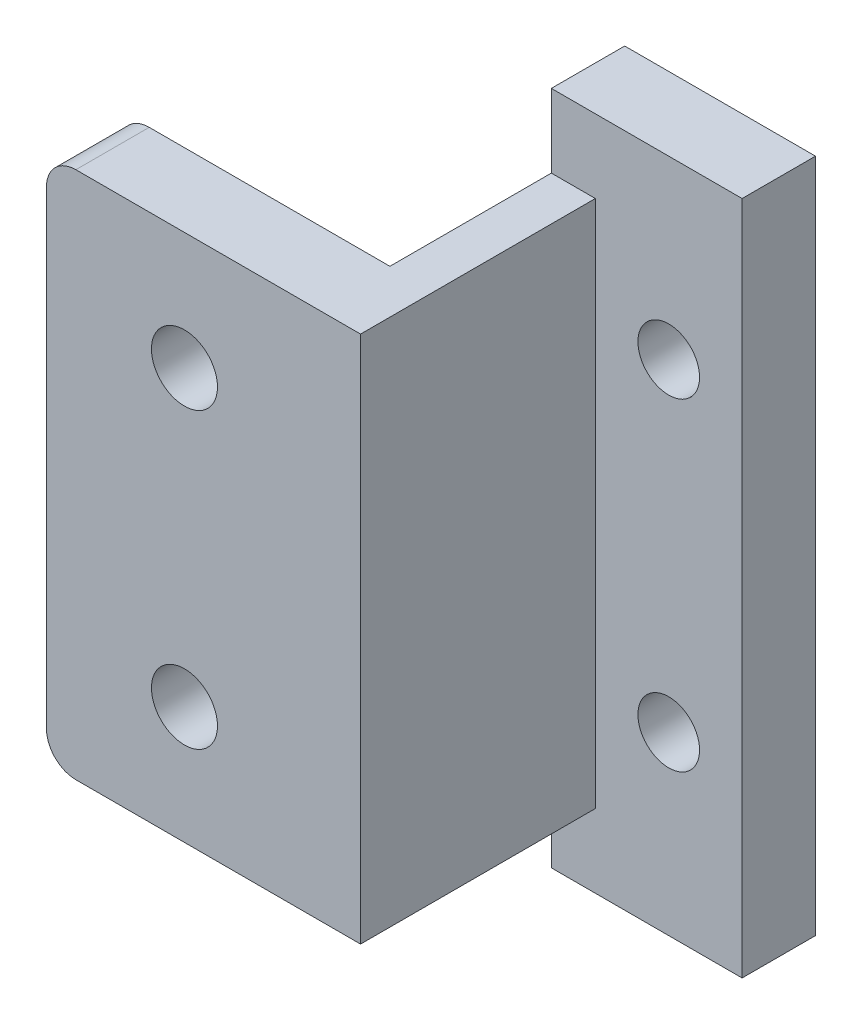
from build123d import *

# Parameters (mm, degrees)
ESQUISSE1_R             = 2.25
BOSS_EXTRU_1_DEPTH      = 5
BOSS_EXTRU_2_START      = -21
BOSS_EXTRU_2_DEPTH      = 21
ESQUISSE4_W             = 13
ESQUISSE4_H             = 46
ENL_V_MAT_EXTRU_2_DEPTH = 16
ESQUISSE9_W             = 16
ESQUISSE9_H             = 36
BOSS_EXTRU_3_DEPTH      = 3
ESQUISSE10_W            = 4
ESQUISSE10_H            = 16
ENL_V_MAT_EXTRU_6_DEPTH = 43
CONG_1_R                = 2
ESQUISSE11_R            = 2.1
ENL_V_MAT_EXTRU_7_DEPTH = 43


with BuildPart() as part:
    # Esquisse1 → Boss.-Extru.1 (new body)
    with BuildSketch(Plane.XY):
        with BuildLine():
            Line((-7.4, 36), (-7.4, 0))
            Line((-7.4, 0), (7, 0))
            ThreePointArc((7, 0), (9.121320344, 0.878679656), (10, 3))
            Line((10, 3), (10, 33))
            ThreePointArc((10, 33), (9.121320344, 35.121320344), (7, 36))
            Line((7, 36), (-7.4, 36))
        make_face()
        with Locations((2, 8)):
            Circle(ESQUISSE1_R, mode=Mode.SUBTRACT)
        with Locations((2, 28)):
            Circle(ESQUISSE1_R, mode=Mode.SUBTRACT)
    extrude(amount=BOSS_EXTRU_1_DEPTH)

    # Esquisse2 → Boss.-Extru.2 (add)
    with BuildSketch(Plane.XY.offset(5).offset(BOSS_EXTRU_2_START)):
        with BuildLine():
            Line((10, 3), (10, 33))
            ThreePointArc((10, 33), (9.121320344, 35.121320344), (7, 36))
            Line((7, 36), (11, 36))
            Line((11, 36), (11, 41))
            Line((11, 41), (24, 41))
            Line((24, 41), (24, -5))
            Line((24, -5), (11, -5))
            Line((11, -5), (11, 0))
            Line((11, 0), (7, 0))
            ThreePointArc((7, 0), (9.121320344, 0.878679656), (10, 3))
        make_face()
    extrude(amount=BOSS_EXTRU_2_DEPTH)

    # Esquisse4 → Enlèv. mat.-Extru.2 (cut)
    with BuildSketch(Plane.XY.offset(5)):
        with Locations((17.5, 18)):
            Rectangle(ESQUISSE4_W, ESQUISSE4_H)
    extrude(amount=-ENL_V_MAT_EXTRU_2_DEPTH, mode=Mode.SUBTRACT)

    # Esquisse9 → Boss.-Extru.3 (add)
    with BuildSketch(Plane(origin=(11, 0, 0), x_dir=(0, 0, -1), z_dir=(1, 0, 0))):
        with Locations((3, 18)):
            Rectangle(ESQUISSE9_W, ESQUISSE9_H)
    extrude(amount=BOSS_EXTRU_3_DEPTH)

    # Esquisse10 → Enlèv. mat.-Extru.6 (cut)
    with BuildSketch(Plane(origin=(0, 36, 0), x_dir=(1, 0, 0), z_dir=(0, 1, 0))):
        with Locations((9, 8)):
            Rectangle(ESQUISSE10_W, ESQUISSE10_H)
    extrude(amount=-ENL_V_MAT_EXTRU_6_DEPTH, mode=Mode.SUBTRACT)

    # Congé1
    cong_1_edges = [part.edges().sort_by_distance(p)[0] for p in [
        (-7.4, 0, 2.5),
        (-7.4, 36, 2.5),
    ]]
    fillet(cong_1_edges, radius=CONG_1_R)

    # Esquisse11 → Enlèv. mat.-Extru.7 (cut)
    with BuildSketch(Plane.XY.offset(-11)):
        with Locations((19, 29)):
            Circle(ESQUISSE11_R)
        with Locations((19, 7)):
            Circle(ESQUISSE11_R)
    extrude(amount=-ENL_V_MAT_EXTRU_7_DEPTH, mode=Mode.SUBTRACT)


solid = part.part
